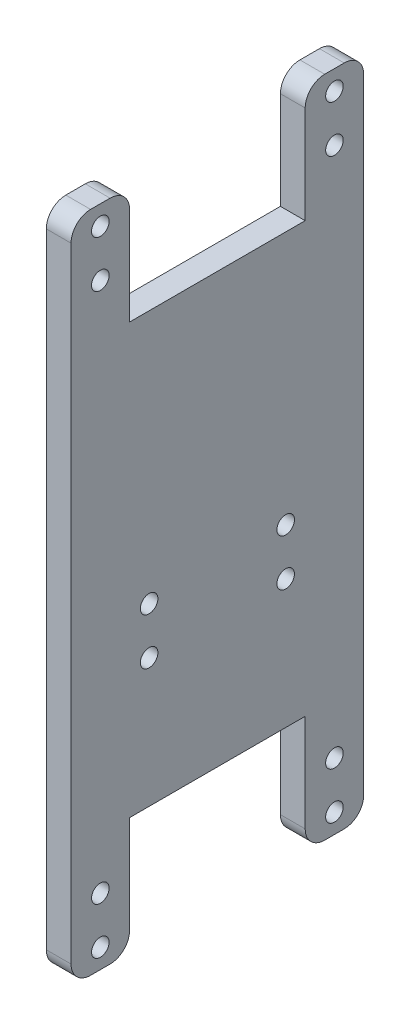
from build123d import *

# Parameters (mm, degrees)
SALIENTE_EXTRUIR1_DEPTH      = 6.35
TALADRO_DE_MARGEN_PARA_M41_D = 4.5
REDONDEO1_R                  = 5
TALADRO_DE_MARGEN_PARA_M42_D = 4.5


with BuildPart() as part:
    # Croquis1 → Saliente-Extruir1 (new body)
    with BuildSketch(Plane(origin=(0, 0, 0), x_dir=(0, 0, -1), z_dir=(1, 0, 0))):
        Polygon((-22.5, 85), (-22.5, 55), (22.5, 55), (22.5, 85), (37.5, 85), (37.5, 35), (37.5, -35), (37.5, -85), (22.5, -85), (22.5, -55), (-22.5, -55), (-22.5, -85), (-37.5, -85), (-37.5, -35), (-37.5, 35), (-37.5, 85), align=None)
    extrude(amount=SALIENTE_EXTRUIR1_DEPTH)

    # Taladro de margen para M41 (through all)
    with Locations(Plane.ZY):
        with Locations((30, 68), (30, 80), (-30, 68), (-30, 80), (30, -80), (30, -68), (-30, -80), (-30, -68)):
            Hole(TALADRO_DE_MARGEN_PARA_M41_D / 2)

    # Redondeo1
    redondeo1_edges = [part.edges().sort_by_distance(p)[0] for p in [
        (3.175, 85, 22.5),
        (3.175, 85, -22.5),
        (3.175, 85, -37.5),
        (3.175, -85, -37.5),
        (3.175, -85, -22.5),
        (3.175, -85, 22.5),
        (3.175, -85, 37.5),
        (3.175, 85, 37.5),
    ]]
    fillet(redondeo1_edges, radius=REDONDEO1_R)

    # Taladro de margen para M42 (through all)
    with Locations(Plane(origin=(6.35, 0, 0), x_dir=(0, 0, -1), z_dir=(1, 0, 0))):
        with Locations((-17.5, -10), (17.5, -10), (17.5, -22), (-17.5, -22)):
            Hole(TALADRO_DE_MARGEN_PARA_M42_D / 2)


solid = part.part
